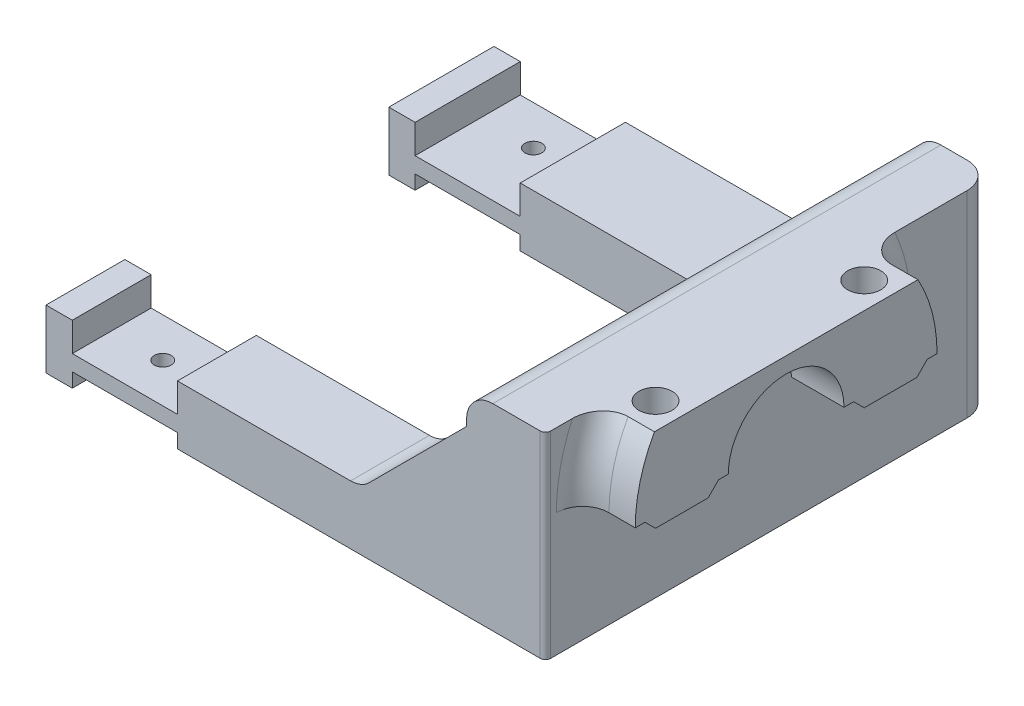
from build123d import *

# Parameters (mm, degrees)
ESBO_O1_W                = 20
ESBO_O1_H                = 15
RESSALTO_EXTRUS_O1_DEPTH = 1.5
ESBO_O2_W                = 5
ESBO_O2_H                = 11.2
RESSALTO_EXTRUS_O2_DEPTH = 15
ESBO_O3_W                = 70
ESBO_O3_H                = 11.2
RESSALTO_EXTRUS_O3_DEPTH = 15
RESSALTO_EXTRUS_O4_DEPTH = 11.2
CORTE_EXTRUS_O1_REACH    = 119.085
ESBO_O5_W                = 20
ESBO_O5_H                = 5.5
ESBO_O5_H_2              = 2.7
RESSALTO_EXTRUS_O5_DEPTH = 15
RESSALTO_EXTRUS_O6_START = 10
RESSALTO_EXTRUS_O6_DEPTH = 10
RESSALTO_EXTRUS_O7_DEPTH = 15
ESBO_O11_R               = 1.8
CORTE_EXTRUS_O2_DEPTH    = 121.824377259
ESBO_O12_R               = 3.15
CORTE_EXTRUS_O3_DEPTH    = 5
RESSALTO_EXTRUS_O8_START = -15
RESSALTO_EXTRUS_O8_DEPTH = 15
CHANFRO1_SIZE            = 20
FILETE1_R                = 5
FILETE4_R                = 1
FILETE5_R                = 5
CORTE_EXTRUS_O4_REACH    = 125.072
ESBO_O14_R               = 1.6


with BuildPart() as part:
    # Esboço1 → Ressalto-extrusão1 (new, symmetric)
    with BuildSketch(Plane(origin=(0, 0, 0), x_dir=(1, 0, 0), z_dir=(0, 1, 0))):
        Rectangle(ESBO_O1_W, ESBO_O1_H)
    extrude(amount=RESSALTO_EXTRUS_O1_DEPTH, both=True)

    # Esboço2 → Ressalto-extrusão2 (add)
    with BuildSketch(Plane.XY.offset(7.5)):
        with Locations((-12.5, 1.4)):
            Rectangle(ESBO_O2_W, ESBO_O2_H)
    extrude(amount=-RESSALTO_EXTRUS_O2_DEPTH)

    # Esboço3 → Ressalto-extrusão3 (add)
    with BuildSketch(Plane.XY.offset(7.5)):
        with Locations((45, 1.4)):
            Rectangle(ESBO_O3_W, ESBO_O3_H)
    extrude(amount=-RESSALTO_EXTRUS_O3_DEPTH)

    # Esboço4 → Ressalto-extrusão4 (add)
    with BuildSketch(Plane(origin=(0, 7, 0), x_dir=(1, 0, 0), z_dir=(0, 1, 0))):
        Polygon((80, 7.5), (65, 7.5), (65, 57.7), (-15, 57.7), (-15, 77.704559326), (80, 77.704559326), (80, 57.7), align=None)
    extrude(amount=-RESSALTO_EXTRUS_O4_DEPTH)

    # Esboço5 → Corte-extrusão1 (cut, up to next)
    with BuildSketch(Plane(origin=(0, 0, -77.704559326), x_dir=(-1, 0, 0), z_dir=(0, 0, -1)), mode=Mode.PRIVATE) as corte_extrus_o1_sk1:
        with Locations((0, 4.25)):
            Rectangle(ESBO_O5_W, ESBO_O5_H)
    corte_extrus_o1_tool1 = extrude(corte_extrus_o1_sk1.sketch, amount=-CORTE_EXTRUS_O1_REACH, mode=Mode.PRIVATE) & part.part
    # Esboço5 → Corte-extrusão1 (cut, up to next)
    with BuildSketch(Plane(origin=(0, 0, -77.704559326), x_dir=(-1, 0, 0), z_dir=(0, 0, -1)), mode=Mode.PRIVATE) as corte_extrus_o1_sk2:
        with Locations((0, -2.85)):
            Rectangle(ESBO_O5_W, ESBO_O5_H_2)
    corte_extrus_o1_tool2 = extrude(corte_extrus_o1_sk2.sketch, amount=-CORTE_EXTRUS_O1_REACH, mode=Mode.PRIVATE) & part.part
    add(corte_extrus_o1_tool1.solids().sort_by_distance((0, 4.25, -77.704559))[0], mode=Mode.SUBTRACT)
    add(corte_extrus_o1_tool2.solids().sort_by_distance((0, -2.85, -77.704559))[0], mode=Mode.SUBTRACT)

    # Esboço6 → Ressalto-extrusão5 (add)
    with BuildSketch(Plane(origin=(80, 0, 0), x_dir=(0, 0, -1), z_dir=(1, 0, 0))):
        with BuildLine():
            Line((-0.425440674, 7), (56.974559326, 7))
            Line((56.974559326, 7), (56.974559326, 19.26))
            ThreePointArc((56.974559326, 19.26), (56.935226103, 20.762058565), (56.817334244, 22.26))
            Line((56.817334244, 22.26), (-0.268215591, 22.26))
            ThreePointArc((-0.268215591, 22.26), (-0.38610745, 20.762058565), (-0.425440674, 19.26))
            Line((-0.425440674, 19.26), (-0.425440674, 7))
        make_face()
    extrude(amount=-RESSALTO_EXTRUS_O5_DEPTH)

    # Esboço7 → Ressalto-extrusão6 (add)
    with BuildSketch(Plane(origin=(80, 0, 0), x_dir=(0, 0, -1), z_dir=(1, 0, 0)).offset(RESSALTO_EXTRUS_O6_START)):
        with BuildLine():
            Line((-0.425440674, 19.26), (1.424559326, 19.26))
            Line((1.424559326, 19.26), (3.424559326, 17.26))
            Line((3.424559326, 17.26), (13.424559326, 17.26))
            Line((13.424559326, 17.26), (15.424559326, 19.26))
            Line((15.424559326, 19.26), (17.274559326, 19.26))
            ThreePointArc((17.274559326, 19.26), (28.274559326, 30.26), (39.274559326, 19.26))
            Line((39.274559326, 19.26), (41.124559326, 19.26))
            Line((41.124559326, 19.26), (43.124559326, 17.26))
            Line((43.124559326, 17.26), (53.124559326, 17.26))
            Line((53.124559326, 17.26), (55.124559326, 19.26))
            Line((55.124559326, 19.26), (56.974559326, 19.26))
            ThreePointArc((56.974559326, 19.26), (56.048039502, 26.493519124), (53.328301562, 33.26))
            Line((53.328301562, 33.26), (3.220817091, 33.26))
            ThreePointArc((3.220817091, 33.26), (0.50107915, 26.493519124), (-0.425440674, 19.26))
        make_face()
    extrude(amount=-RESSALTO_EXTRUS_O6_DEPTH)

    # Esboço8 → Ressalto-extrusão7 (add)
    with BuildSketch(Plane.ZY.offset(-80)):
        with BuildLine():
            Line((0.268215591, 22.26), (-56.817334244, 22.26))
            ThreePointArc((-56.817334244, 22.26), (-55.63139874, 27.937173345), (-53.328301562, 33.26))
            Line((-53.328301562, 33.26), (-3.220817091, 33.26))
            ThreePointArc((-3.220817091, 33.26), (-0.917719912, 27.937173345), (0.268215591, 22.26))
        make_face()
    extrude(amount=RESSALTO_EXTRUS_O7_DEPTH)

    # Esboço11 → Corte-extrusão2 (cut, through all)
    with BuildSketch(Plane.XZ.offset(-17.26)):
        with Locations(Location((85, -8.424559326, 0), (0, 0, 270))):
            Circle(ESBO_O11_R)
        with Locations(Location((85, -48.124559326, 0), (0, 0, 270))):
            Circle(ESBO_O11_R)
    extrude(amount=-CORTE_EXTRUS_O2_DEPTH, mode=Mode.SUBTRACT)

    # Esboço12 → Corte-extrusão3 (cut)
    with BuildSketch(Plane(origin=(0, 33.26, 0), x_dir=(1, 0, 0), z_dir=(0, 1, 0))):
        with Locations(Location((85, 48.124559326, 0), (0, 0, 270))):
            Circle(ESBO_O12_R)
        with Locations(Location((85, 8.424559326, 0), (0, 0, 270))):
            Circle(ESBO_O12_R)
    extrude(amount=-CORTE_EXTRUS_O3_DEPTH, mode=Mode.SUBTRACT)

    # Esboço13 → Ressalto-extrusão8 (add)
    with BuildSketch(Plane.ZY.offset(-65).offset(RESSALTO_EXTRUS_O8_START)):
        with BuildLine():
            Line((0.425440674, 7), (7.5, 7))
            Line((7.5, 7), (7.5, 33.26))
            Line((7.5, 33.26), (-3.220817091, 33.26))
            ThreePointArc((-3.220817091, 33.26), (-0.50107915, 26.493519124), (0.425440674, 19.26))
            Line((0.425440674, 19.26), (0.425440674, 7))
        make_face()
        with BuildLine():
            Line((-56.974559326, 7), (-77.704559326, 7))
            Line((-77.704559326, 7), (-77.704559326, 33.26))
            Line((-77.704559326, 33.26), (-53.328301562, 33.26))
            ThreePointArc((-53.328301562, 33.26), (-56.048039502, 26.493519124), (-56.974559326, 19.26))
            Line((-56.974559326, 19.26), (-56.974559326, 7))
        make_face()
    extrude(amount=RESSALTO_EXTRUS_O8_DEPTH)

    # Chanfro1
    chanfro1_edges = [part.edges().sort_by_distance(p)[0] for p in [
        (65, 7, -67.702279663),
        (65, 7, 0),
    ]]
    chamfer(chanfro1_edges, length=CHANFRO1_SIZE)

    # Filete1
    filete1_edges = [part.edges().sort_by_distance(p)[0] for p in [
        (65, 33.26, -35.102279663),
        (80, 26.493519124, -0.50107915),
        (80, 26.493519124, -56.048039502),
    ]]
    fillet(filete1_edges, radius=FILETE1_R)

    # Filete4
    filete4_edges = [part.edges().sort_by_distance(p)[0] for p in [
        (80, 14.53, 7.5),
    ]]
    fillet(filete4_edges, radius=FILETE4_R)

    # Filete5
    filete5_edges = [part.edges().sort_by_distance(p)[0] for p in [
        (45, 7, -67.702279663),
        (45, 7, 0),
        (80, 14.53, -77.704559326),
    ]]
    fillet(filete5_edges, radius=FILETE5_R)

    # Esboço14 → Corte-extrusão4 (cut, up to next)
    with BuildSketch(Plane(origin=(0, 1.5, 0), x_dir=(1, 0, 0), z_dir=(0, 1, 0)), mode=Mode.PRIVATE) as corte_extrus_o4_sk1:
        with Locations(Location((-0.3, 0, 0), (0, 0, 270))):
            Circle(ESBO_O14_R)
    corte_extrus_o4_tool1 = extrude(corte_extrus_o4_sk1.sketch, amount=-CORTE_EXTRUS_O4_REACH, mode=Mode.PRIVATE) & part.part
    # Esboço14 → Corte-extrusão4 (cut, up to next)
    with BuildSketch(Plane(origin=(0, 1.5, 0), x_dir=(1, 0, 0), z_dir=(0, 1, 0)), mode=Mode.PRIVATE) as corte_extrus_o4_sk2:
        with Locations(Location((0, 70.204559326, 0), (0, 0, 270))):
            Circle(ESBO_O14_R)
    corte_extrus_o4_tool2 = extrude(corte_extrus_o4_sk2.sketch, amount=-CORTE_EXTRUS_O4_REACH, mode=Mode.PRIVATE) & part.part
    add(corte_extrus_o4_tool1.solids().sort_by_distance((-0.3, 1.5, 0))[0], mode=Mode.SUBTRACT)
    add(corte_extrus_o4_tool2.solids().sort_by_distance((0, 1.5, -70.204559))[0], mode=Mode.SUBTRACT)


solid = part.part
